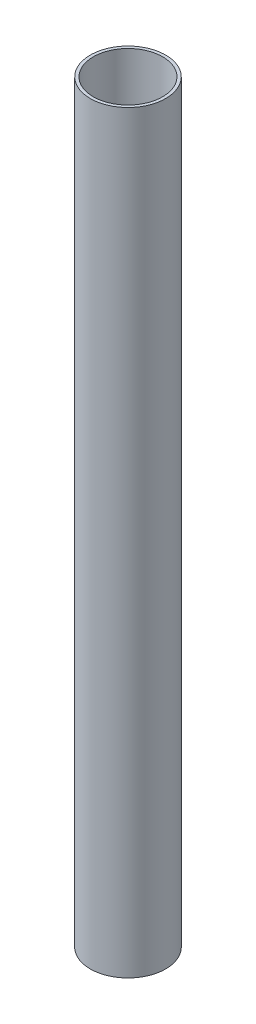
from build123d import *

# Parameters (mm, degrees)
SKETCH1_R           = 1.5875
BOSS_EXTRUDE1_DEPTH = 31.75
SHELL4_T            = -0.127


with BuildPart() as part:
    # Sketch1 → Boss-Extrude1 (new body)
    with BuildSketch(Plane(origin=(0, 0, 0), x_dir=(1, 0, 0), z_dir=(0, 1, 0))):
        with Locations(Location((0, 0, 0), (0, 0, 270))):
            Circle(SKETCH1_R)
    extrude(amount=BOSS_EXTRUDE1_DEPTH)

    # Shell4
    shell4_openings = [part.faces().sort_by_distance(p)[0] for p in [
        (0, 31.75, 0),
        (0, 0, 0),
    ]]
    offset(amount=SHELL4_T, openings=shell4_openings, kind=Kind.INTERSECTION)


solid = part.part
